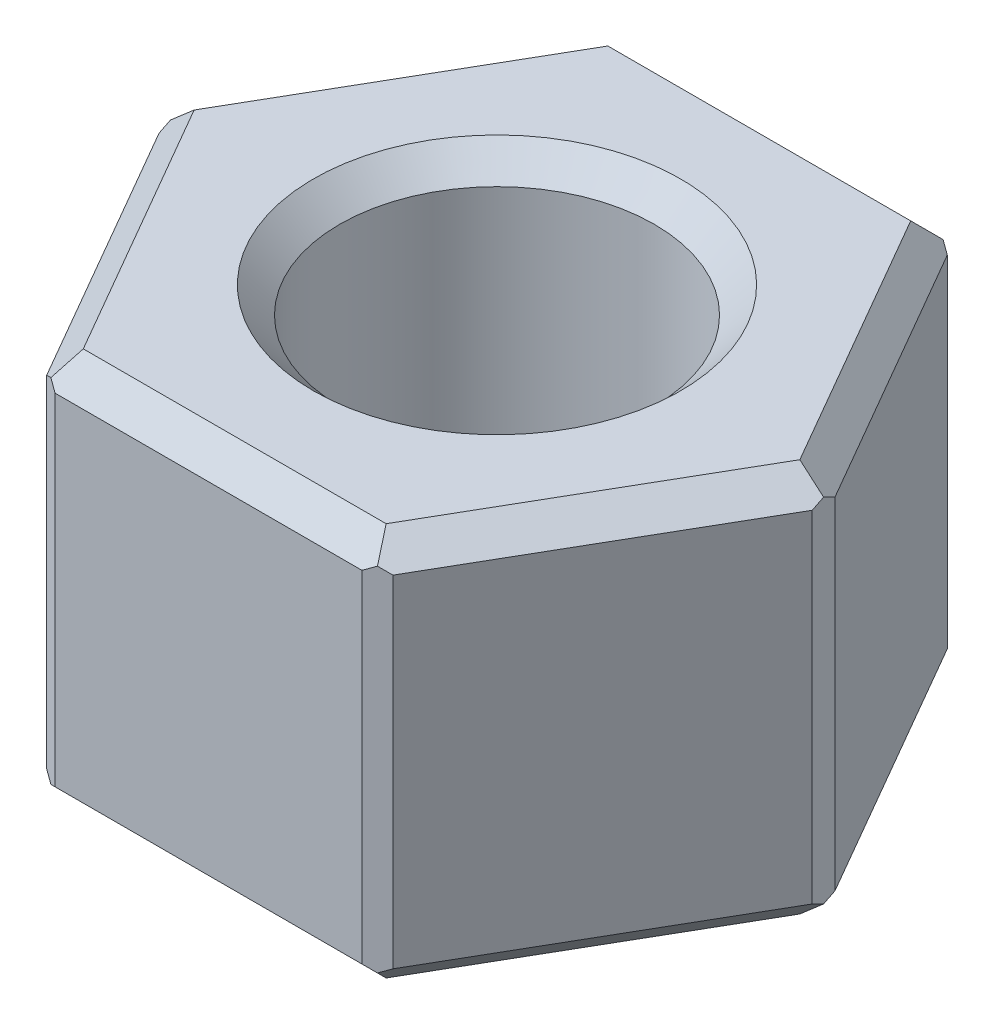
from build123d import *

# Parameters (mm, degrees)
SKETCH1_R           = 6
EXTRUDE1_DEPTH      = 15
SMUSSO2_SIZE        = 1
SMUSSO3_SIZE        = 0.5
SMUSSO3_EDGE_2_SIZE = 0.5
SMUSSO3_EDGE_3_SIZE = 0.5
SMUSSO3_EDGE_4_SIZE = 0.5
SMUSSO3_EDGE_5_SIZE = 0.5
SMUSSO3_EDGE_6_SIZE = 0.5


with BuildPart() as part:
    # Sketch1 → Extrude1 (new body)
    with BuildSketch(Plane(origin=(0, 0, 0), x_dir=(1, 0, 0), z_dir=(0, 1, 0))):
        Polygon((6.350852961, -11), (12.701705922, 0), (6.350852961, 11), (-6.350852961, 11), (-12.701705922, 0), (-6.350852961, -11), align=None)
        with Locations(Location((0, 0, 0), (0, 0, 270))):
            Circle(SKETCH1_R, mode=Mode.SUBTRACT)
    extrude(amount=EXTRUDE1_DEPTH)

    # Smusso2
    smusso2_edges = [part.edges().sort_by_distance(p)[0] for p in [
        (9.526279442, 15, -5.5),
        (0, 15, -11),
        (0, 0, -6),
        (0, 15, -6),
        (-9.526279442, 15, -5.5),
        (-9.526279442, 15, 5.5),
        (0, 15, 11),
        (-9.526279442, 0, 5.5),
        (-9.526279442, 0, -5.5),
        (0, 0, -11),
        (9.526279442, 0, -5.5),
        (9.526279442, 0, 5.5),
        (0, 0, 11),
        (9.526279442, 15, 5.5),
    ]]
    chamfer(smusso2_edges, length=SMUSSO2_SIZE)

    # Smusso3
    smusso3_edges = [part.edges().sort_by_distance(p)[0] for p in [
        (12.701705922, 7.5, 0),
    ]]
    chamfer(smusso3_edges, length=SMUSSO3_SIZE)

    # Smusso3 edge 2
    smusso3_edge_2_edges = [part.edges().sort_by_distance(p)[0] for p in [
        (6.350852961, 7.5, 11),
    ]]
    chamfer(smusso3_edge_2_edges, length=SMUSSO3_EDGE_2_SIZE)

    # Smusso3 edge 3
    smusso3_edge_3_edges = [part.edges().sort_by_distance(p)[0] for p in [
        (6.350852961, 7.5, -11),
    ]]
    chamfer(smusso3_edge_3_edges, length=SMUSSO3_EDGE_3_SIZE)

    # Smusso3 edge 4
    smusso3_edge_4_edges = [part.edges().sort_by_distance(p)[0] for p in [
        (-6.350852961, 7.5, -11),
    ]]
    chamfer(smusso3_edge_4_edges, length=SMUSSO3_EDGE_4_SIZE)

    # Smusso3 edge 5
    smusso3_edge_5_edges = [part.edges().sort_by_distance(p)[0] for p in [
        (-12.701705922, 7.5, 0),
    ]]
    chamfer(smusso3_edge_5_edges, length=SMUSSO3_EDGE_5_SIZE)

    # Smusso3 edge 6
    smusso3_edge_6_edges = [part.edges().sort_by_distance(p)[0] for p in [
        (-6.350852961, 7.5, 11),
    ]]
    chamfer(smusso3_edge_6_edges, length=SMUSSO3_EDGE_6_SIZE)


solid = part.part
